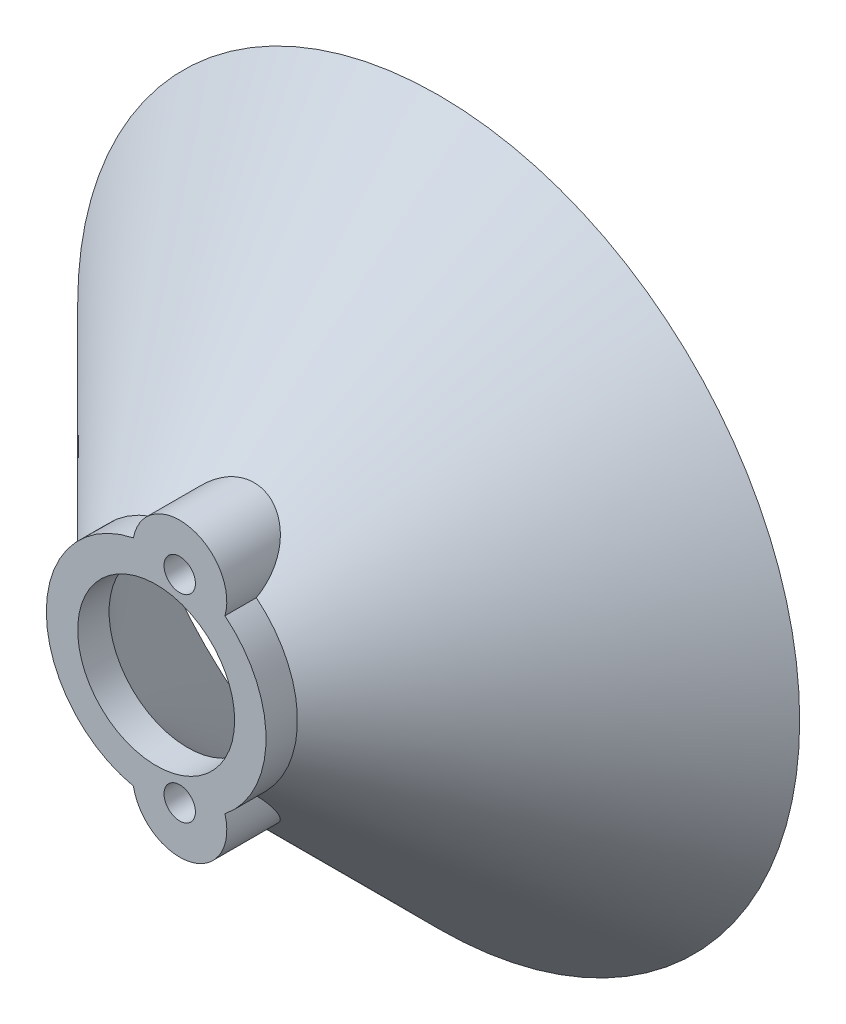
from build123d import *

# Parameters (mm, degrees)
SKETCH_1_R          = 1
SKETCH_1_R_2        = 5
EXTRUDE_1_DEPTH     = 2
SKETCH_2_R          = 7
EXTRUDE_2_DEPTH     = 16
EXTRUDE_2_DRAFT     = -45
SKETCH_3_R          = 5
CUT_EXTRUDE_1_DEPTH = 37.249137921
CUT_EXTRUDE_1_DRAFT = 45
EXTRUDE_3_REACH     = 38.249
EXTRUDE_5_REACH     = 38.249
SKETCH_5_R          = 1


with BuildPart() as part:
    # Эскиз1 → Бобышка-Вытянуть1 (new body)
    with BuildSketch(Plane.XY):
        with BuildLine():
            ThreePointArc((-1.4494714, 6.848286841), (-7, 0), (-1.4494714, -6.848286841))
            ThreePointArc((-1.4494714, -6.848286841), (2.194861582, -9.218418644), (4.380086565, -5.46029685))
            ThreePointArc((4.380086565, -5.46029685), (7, 0), (4.380086565, 5.46029685))
            ThreePointArc((4.380086565, 5.46029685), (2.194861582, 9.218418644), (-1.4494714, 6.848286841))
        make_face()
        with Locations((1.5, 6.3)):
            Circle(SKETCH_1_R, mode=Mode.SUBTRACT)
        with Locations((1.5, -6.3)):
            Circle(SKETCH_1_R, mode=Mode.SUBTRACT)
        Circle(SKETCH_1_R_2, mode=Mode.SUBTRACT)
    extrude(amount=EXTRUDE_1_DEPTH)


with BuildPart() as extrude_2_tool:
    # Эскиз2 → Бобышка-Вытянуть2 (with draft: the straight prism first)
    with BuildSketch(Plane(origin=(0, 0, 0), x_dir=(-1, 0, 0), z_dir=(0, 0, -1))):
        Circle(SKETCH_2_R)
    extrude(amount=EXTRUDE_2_DEPTH)
    # Бобышка-Вытянуть2: the draft: its side faces are tilted about the plane it starts from
    extrude_2_sides = [extrude_2_tool.faces().sort_by_distance(p)[0] for p in [
        (7, 0, -8),
    ]]
    draft(extrude_2_sides, Plane(origin=(0, 0, 0), x_dir=(-1, 0, 0), z_dir=(0, 0, -1)), EXTRUDE_2_DRAFT)


with BuildPart() as part_1:
    add(part.part)

    # Бобышка-Вытянуть2: add extrude_2_tool
    add(extrude_2_tool.part)


with BuildPart() as cut_extrude_1_tool:
    # Эскиз3 → Вырез-Вытянуть1 (with draft: the straight prism first)
    with BuildSketch(Plane.XY):
        Circle(SKETCH_3_R)
    extrude(amount=-CUT_EXTRUDE_1_DEPTH)
    # Вырез-Вытянуть1: the draft: its side faces are tilted about the plane it starts from
    cut_extrude_1_sides = [cut_extrude_1_tool.faces().sort_by_distance(p)[0] for p in [
        (-5, 0, -18.62456896),
    ]]
    draft(cut_extrude_1_sides, Plane.XY, CUT_EXTRUDE_1_DRAFT)


with BuildPart() as part_2:
    add(part_1.part)

    # Вырез-Вытянуть1: cut by cut_extrude_1_tool
    add(cut_extrude_1_tool.part, mode=Mode.SUBTRACT)

    # Эскиз4 → Бобышка-Вытянуть3 (add, up to next)
    with BuildSketch(Plane(origin=(0, 0, 0), x_dir=(-1, 0, 0), z_dir=(0, 0, -1)), mode=Mode.PRIVATE) as extrude_3_sk1:
        with BuildLine():
            ThreePointArc((-4.380086565, -5.46029685), (-3.467221669, -6.080984616), (-2.468130818, -6.550445043))
            ThreePointArc((-2.468130818, -6.550445043), (-1.731620527, -7.272806215), (-0.74860738, -6.959855386))
            ThreePointArc((-0.74860738, -6.959855386), (0.354844302, -6.991000323), (1.4494714, -6.848286841))
            ThreePointArc((1.4494714, -6.848286841), (-2.194861582, -9.218418644), (-4.380086565, -5.46029685))
        make_face()
    extrude_3_tool1 = extrude(extrude_3_sk1.sketch, amount=EXTRUDE_3_REACH, mode=Mode.PRIVATE) - part_2.part
    # Эскиз4 → Бобышка-Вытянуть3 (add, up to next)
    with BuildSketch(Plane(origin=(0, 0, 0), x_dir=(-1, 0, 0), z_dir=(0, 0, -1)), mode=Mode.PRIVATE) as extrude_3_sk2:
        with BuildLine():
            ThreePointArc((1.4494714, 6.848286841), (0.354844302, 6.991000323), (-0.74860738, 6.959855386))
            ThreePointArc((-0.74860738, 6.959855386), (-1.731620527, 7.272806215), (-2.468130818, 6.550445043))
            ThreePointArc((-2.468130818, 6.550445043), (-3.467221669, 6.080984616), (-4.380086565, 5.46029685))
            ThreePointArc((-4.380086565, 5.46029685), (-2.194861582, 9.218418644), (1.4494714, 6.848286841))
        make_face()
    extrude_3_tool2 = extrude(extrude_3_sk2.sketch, amount=EXTRUDE_3_REACH, mode=Mode.PRIVATE) - part_2.part
    add(extrude_3_tool1.solids().sort_by_distance((1.839664, -7.72659, 0))[0])
    add(extrude_3_tool2.solids().sort_by_distance((1.839664, 7.72659, 0))[0])

    # Эскиз5 → Бобышка-Вытянуть5 (add, up to next)
    with BuildSketch(Plane.XY, mode=Mode.PRIVATE) as extrude_5_sk1:
        with Locations((1.5, 6.3)):
            Circle(SKETCH_5_R)
    extrude_5_tool1 = extrude(extrude_5_sk1.sketch, amount=-EXTRUDE_5_REACH, mode=Mode.PRIVATE) - part_2.part
    # Эскиз5 → Бобышка-Вытянуть5 (add, up to next)
    with BuildSketch(Plane.XY, mode=Mode.PRIVATE) as extrude_5_sk2:
        with Locations((1.5, -6.3)):
            Circle(SKETCH_5_R)
    extrude_5_tool2 = extrude(extrude_5_sk2.sketch, amount=-EXTRUDE_5_REACH, mode=Mode.PRIVATE) - part_2.part
    add(extrude_5_tool1.solids().sort_by_distance((1.5, 6.3, 0))[0])
    add(extrude_5_tool2.solids().sort_by_distance((1.5, -6.3, 0))[0])


solid = part_2.part
